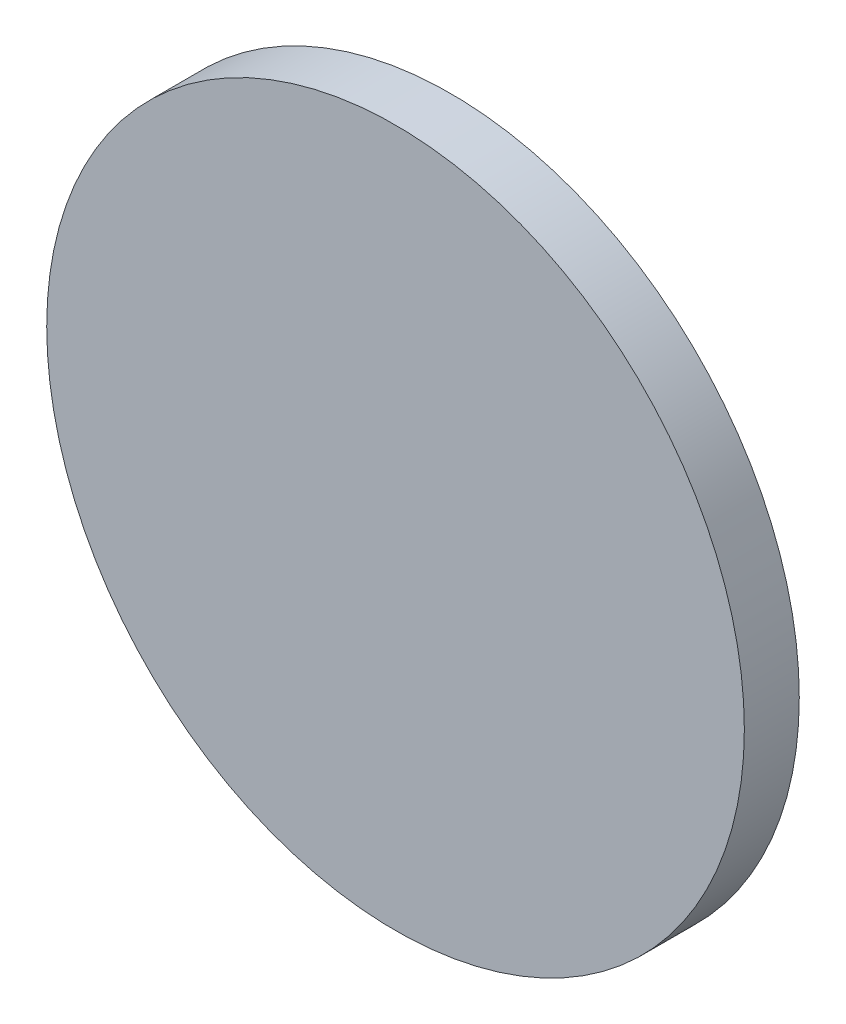
from build123d import *

# Parameters (mm, degrees)
SKETCH1_R        = 12.7
EXTRUSION1_DEPTH = 2


with BuildPart() as part:
    # Sketch1 → Extrusion1 (new body)
    with BuildSketch(Plane.XY):
        Circle(SKETCH1_R)
    extrude(amount=EXTRUSION1_DEPTH)


solid = part.part
